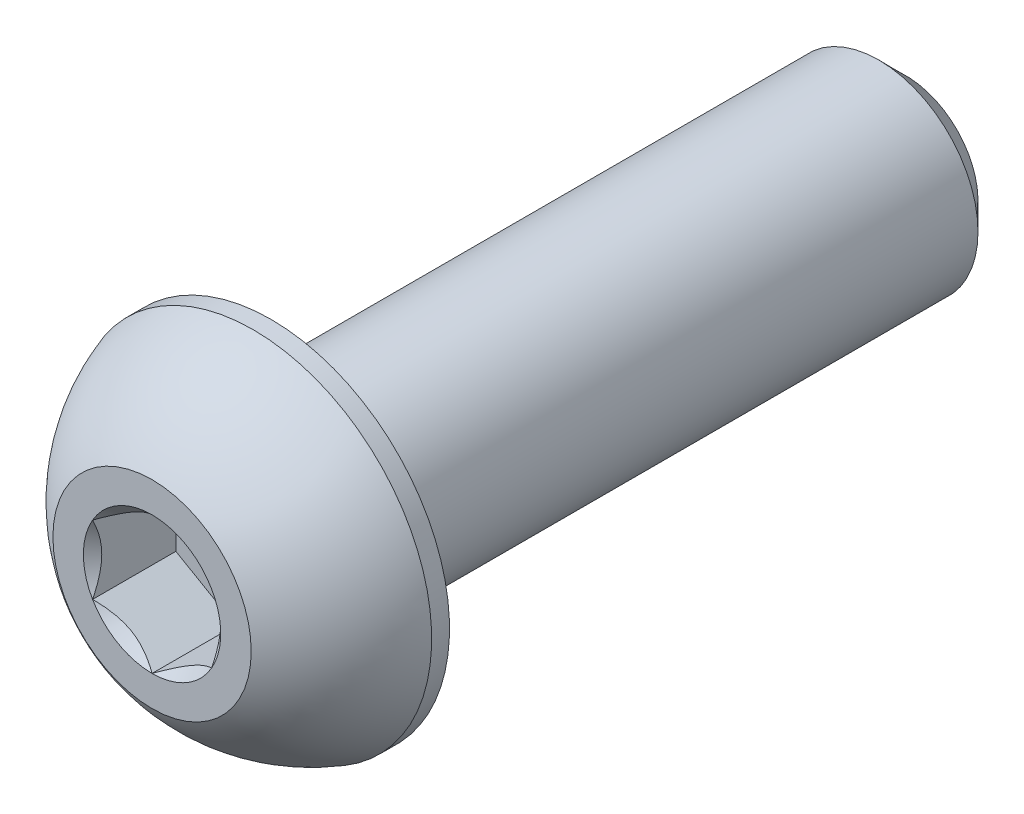
from build123d import *

# Parameters (mm, degrees)
CUT_EXTRUDE2_DEPTH = 1.05


with BuildPart() as part:
    # Sketch10 → Revolve3 (revolve)
    with BuildSketch(Plane(origin=(0, 0, 0), x_dir=(0, 0, -1), z_dir=(1, 0, 0))):
        Polygon((3.6625, 1.25), (4, 0.9125), (4, 0), (-4, 0), (-4, 1.25), align=None)
    revolve(axis=Axis((0, 0, 5.5), (0, 0, -1)))

    # Sketch7 → Revolve2 (revolve)
    with BuildSketch(Plane(origin=(0, 0, 0), x_dir=(0, 0, -1), z_dir=(1, 0, 0))):
        with BuildLine():
            Line((-4.225, 2.25), (-4, 2.25))
            Line((-4, 2.25), (-4, 0))
            Line((-4, 0), (-5.5, 0))
            Line((-5.5, 0), (-5.5, 1.25))
            ThreePointArc((-5.5, 1.25), (-4.950735294, 1.8625), (-4.225, 2.25))
        make_face()
    revolve(axis=Axis((0, 0, 5.5), (0, 0, -1)))

    # Sketch5 → Cut-Extrude2 (cut)
    with BuildSketch(Plane.XY.offset(5.5)):
        Polygon((0.75, -0.433012702), (0.75, 0.433012702), (0, 0.866025404), (-0.75, 0.433012702), (-0.75, -0.433012702), (0, -0.866025404), align=None)
    extrude(amount=-CUT_EXTRUDE2_DEPTH, mode=Mode.SUBTRACT)

    # Cut-Extrude3 cone 1 section (through the dimple's axis) → Cut-Extrude3 (revolve, cut)
    with BuildSketch(Plane(origin=(0, 0, 5.5), x_dir=(0, -1, 0), z_dir=(1, 0, 0))):
        Polygon((0, 0), (0.866025404, 0), (0, 0.866025404), align=None)
    revolve(axis=Axis((0, 0, 5.5), (0, 0, -1)), mode=Mode.SUBTRACT)


solid = part.part
